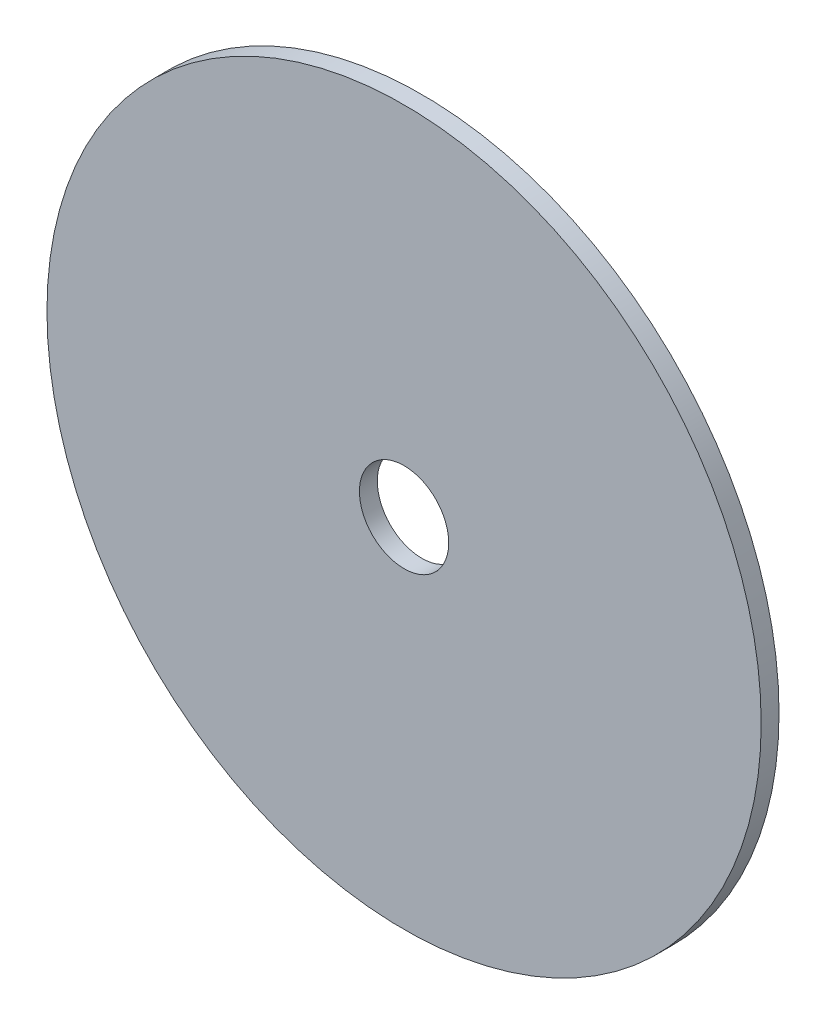
from build123d import *

# Parameters (mm, degrees)
SKETCH_1_R      = 40
SKETCH_1_R_2    = 5
EXTRUDE_1_DEPTH = 2


with BuildPart() as part:
    # 草图1 → 凸台-拉伸1 (new body)
    with BuildSketch(Plane.XY):
        Circle(SKETCH_1_R)
        Circle(SKETCH_1_R_2, mode=Mode.SUBTRACT)
    extrude(amount=EXTRUDE_1_DEPTH)


solid = part.part
